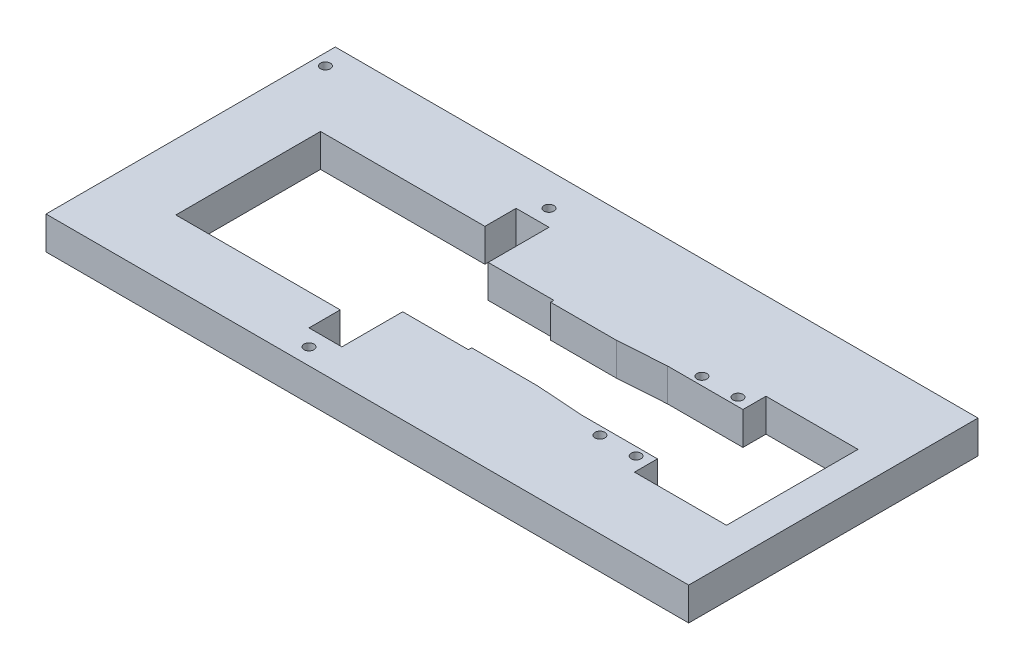
from build123d import *

# Parameters (mm, degrees)
SKETCH_1_W      = 195.5
SKETCH_1_H      = 88
SKETCH_1_R      = 1.5
EXTRUDE_1_DEPTH = 10


with BuildPart() as part:
    # Эскиз1 → Бобышка-Вытянуть1 (new body)
    with BuildSketch(Plane(origin=(0, 0, 0), x_dir=(1, 0, 0), z_dir=(0, 1, 0))):
        with Locations((-50.25, 2.5)):
            Rectangle(SKETCH_1_W, SKETCH_1_H)
        with Locations(Location((-5.5, 15.5, 0), (0, 0, 270))):
            Circle(SKETCH_1_R, mode=Mode.SUBTRACT)
        with Locations(Location((5.5, 15.5, 0), (0, 0, 270))):
            Circle(SKETCH_1_R, mode=Mode.SUBTRACT)
        with Locations(Location((-5.5, -15.5, 0), (0, 0, 270))):
            Circle(SKETCH_1_R, mode=Mode.SUBTRACT)
        with Locations(Location((5.5, -15.5, 0), (0, 0, 270))):
            Circle(SKETCH_1_R, mode=Mode.SUBTRACT)
        with Locations(Location((-73, 36.5, 0), (0, 0, 270))):
            Circle(SKETCH_1_R, mode=Mode.SUBTRACT)
        with Locations(Location((-73, -36.5, 0), (0, 0, 270))):
            Circle(SKETCH_1_R, mode=Mode.SUBTRACT)
        with Locations(Location((-144.5, 40, 0), (0, 0, 270))):
            Circle(SKETCH_1_R, mode=Mode.SUBTRACT)
        Polygon((-13.5, 13), (-28, 12), (-48, 12), (-48, 13), (-68, 13), (-68, 31.5), (-78, 31.5), (-78, 22), (-128, 22), (-128, -22), (-78, -22), (-78, -31.5), (-68, -31.5), (-68, -13), (-48, -13), (-48, -12), (-28, -12), (-13.5, -13), (9.5, -13), (9.5, -20), (37.5, -20), (37.5, 20), (9.5, 20), (9.5, 13), align=None, mode=Mode.SUBTRACT)
    extrude(amount=EXTRUDE_1_DEPTH)


solid = part.part
